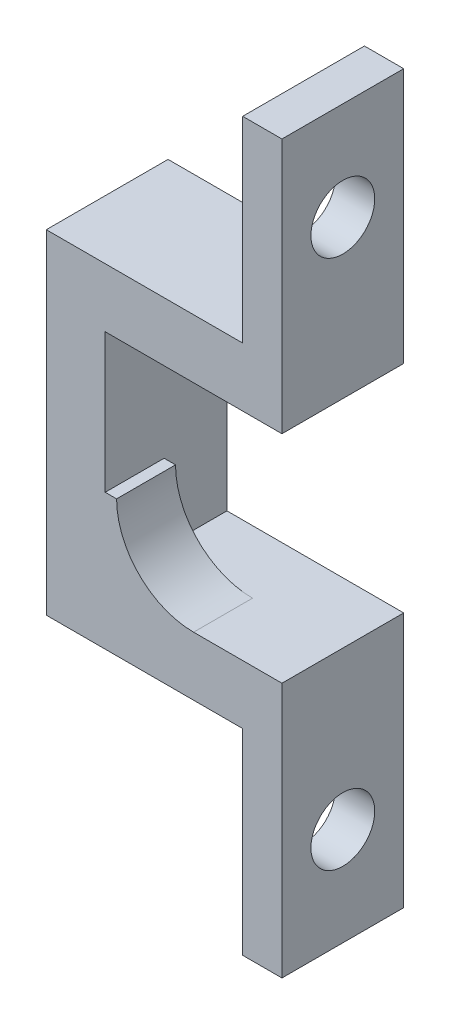
from build123d import *

# Parameters (mm, degrees)
EXTRUDE_1_DEPTH     = 3
EXTRUDE_5_DEPTH     = 3.2
SKETCH_6_W          = 2
SKETCH_6_H          = 6.2
EXTRUDE_6_DEPTH     = 10
SKETCH_7_W          = 2
SKETCH_7_H          = 6.2
EXTRUDE_7_DEPTH     = 10
CUT_EXTRUDE_1_REACH = 23.341
SKETCH_8_R          = 1.625


with BuildPart() as part:
    # 草圖1 → 填料-伸長1 (new body)
    with BuildSketch(Plane.XY):
        with BuildLine():
            Line((5.864342343, -5.42098501), (5.864342343, -8.42098501))
            Line((5.864342343, -8.42098501), (-6.135657657, -8.42098501))
            Line((-6.135657657, -8.42098501), (-6.135657657, 8.57901499))
            Line((-6.135657657, 8.57901499), (5.864342343, 8.57901499))
            Line((5.864342343, 8.57901499), (5.864342343, 5.57901499))
            Line((5.864342343, 5.57901499), (-3.135657657, 5.57901499))
            Line((-3.135657657, 5.57901499), (-3.135657657, -1.50098501))
            Line((-3.135657657, -1.50098501), (-2.555657657, -1.50098501))
            ThreePointArc((-2.555657657, -1.50098501), (-1.407516239, -4.272843593), (1.364342343, -5.42098501))
            Line((1.364342343, -5.42098501), (5.864342343, -5.42098501))
        make_face()
    extrude(amount=EXTRUDE_1_DEPTH)

    # 草圖5 → 填料-伸長5 (add)
    with BuildSketch(Plane(origin=(0, 0, 0), x_dir=(-1, 0, 0), z_dir=(0, 0, -1))):
        Polygon((3.135657657, 5.57901499), (-5.864342343, 5.57901499), (-5.864342343, 8.57901499), (6.135657657, 8.57901499), (6.135657657, -8.42098501), (-5.864342343, -8.42098501), (-5.864342343, -5.42098501), (3.135657657, -5.42098501), align=None)
    extrude(amount=EXTRUDE_5_DEPTH)

    # 草圖6 → 填料-伸長6 (add)
    with BuildSketch(Plane(origin=(0, 8.57901499, 0), x_dir=(1, 0, 0), z_dir=(0, 1, 0))):
        with Locations((4.864342343, 0.1)):
            Rectangle(SKETCH_6_W, SKETCH_6_H)
    extrude(amount=EXTRUDE_6_DEPTH)

    # 草圖7 → 填料-伸長7 (add)
    with BuildSketch(Plane.XZ.offset(8.42098501)):
        with Locations((4.864342343, -0.1)):
            Rectangle(SKETCH_7_W, SKETCH_7_H)
    extrude(amount=EXTRUDE_7_DEPTH)

    # 草圖8 → 除料-伸長1 (cut, up to next)
    with BuildSketch(Plane.ZY.offset(-3.864342343), mode=Mode.PRIVATE) as cut_extrude_1_sk1:
        with Locations(Location((-0.1, -13.42098501, 0), (0, 0, 270))):
            Circle(SKETCH_8_R)
    cut_extrude_1_tool1 = extrude(cut_extrude_1_sk1.sketch, amount=-CUT_EXTRUDE_1_REACH, mode=Mode.PRIVATE) & part.part
    # 草圖8 → 除料-伸長1 (cut, up to next)
    with BuildSketch(Plane.ZY.offset(-3.864342343), mode=Mode.PRIVATE) as cut_extrude_1_sk2:
        with Locations(Location((-0.1, 13.57901499, 0), (0, 0, 270))):
            Circle(SKETCH_8_R)
    cut_extrude_1_tool2 = extrude(cut_extrude_1_sk2.sketch, amount=-CUT_EXTRUDE_1_REACH, mode=Mode.PRIVATE) & part.part
    add(cut_extrude_1_tool1.solids().sort_by_distance((3.864342, -13.420985, -0.1))[0], mode=Mode.SUBTRACT)
    add(cut_extrude_1_tool2.solids().sort_by_distance((3.864342, 13.579015, -0.1))[0], mode=Mode.SUBTRACT)


solid = part.part
